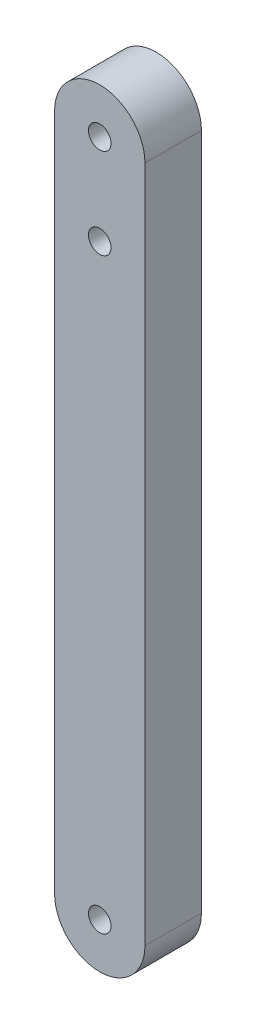
from build123d import *

# Parameters (mm, degrees)
ESQUISSE1_R        = 2
BOSS_EXTRU_1_DEPTH = 10


with BuildPart() as part:
    # Esquisse1 → Boss.-Extru.1 (new body)
    with BuildSketch(Plane.XY):
        with BuildLine():
            Line((-8, 0), (-8, 120))
            ThreePointArc((-8, 120), (0, 128), (8, 120))
            Line((8, 120), (8, 0))
            ThreePointArc((8, 0), (0, -8), (-8, 0))
        make_face()
        with Locations((0, 120)):
            Circle(ESQUISSE1_R, mode=Mode.SUBTRACT)
        Circle(ESQUISSE1_R, mode=Mode.SUBTRACT)
        with Locations((0, 104)):
            Circle(ESQUISSE1_R, mode=Mode.SUBTRACT)
    extrude(amount=BOSS_EXTRU_1_DEPTH)


solid = part.part
